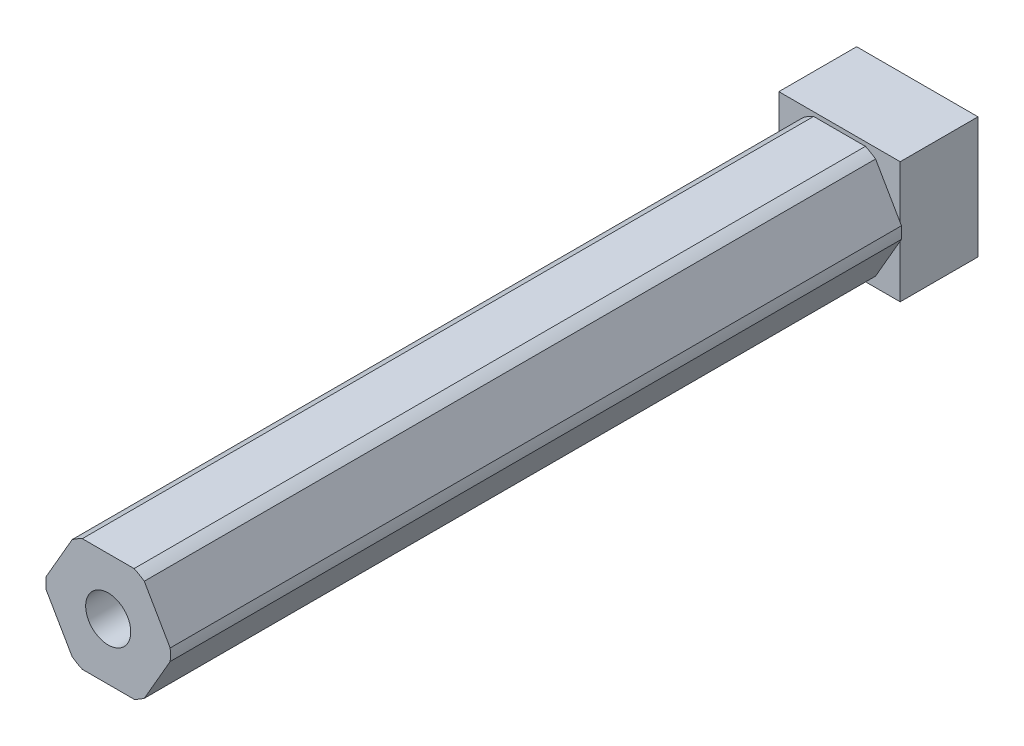
from build123d import *

# Parameters (mm, degrees)
EXTRUDE_1_DEPTH     = 47
SKETCH_2_W          = 7.8
SKETCH_2_H          = 7.8
EXTRUDE_2_DEPTH     = 5
SKETCH_3_R          = 1.45
CUT_EXTRUDE_1_DEPTH = 12.5
SKETCH_4_R          = 3
CUT_EXTRUDE_2_DEPTH = 3
CUT_EXTRUDE_START   = -42.5
SKETCH_3_2_R        = 1.45
CUT_EXTRUDE_3_DEPTH = 9.5


with BuildPart() as part:
    # Эскиз1 → Бобышка-Вытянуть1 (new body)
    with BuildSketch(Plane.XY):
        with BuildLine():
            Line((1.664331698, 3.637306696), (-1.664331698, 3.637306696))
            ThreePointArc((-1.664331698, 3.637306696), (-2, 3.464101615), (-2.317834151, 3.260006878))
            Line((-2.317834151, 3.260006878), (-3.982165849, 0.377299817))
            ThreePointArc((-3.982165849, 0.377299817), (-4, 0), (-3.982165849, -0.377299817))
            Line((-3.982165849, -0.377299817), (-2.317834151, -3.260006878))
            ThreePointArc((-2.317834151, -3.260006878), (-2, -3.464101615), (-1.664331698, -3.637306696))
            Line((-1.664331698, -3.637306696), (1.664331698, -3.637306696))
            ThreePointArc((1.664331698, -3.637306696), (2, -3.464101615), (2.317834151, -3.260006878))
            Line((2.317834151, -3.260006878), (3.982165849, -0.377299817))
            ThreePointArc((3.982165849, -0.377299817), (4, 0), (3.982165849, 0.377299817))
            Line((3.982165849, 0.377299817), (2.317834151, 3.260006878))
            ThreePointArc((2.317834151, 3.260006878), (2, 3.464101615), (1.664331698, 3.637306696))
        make_face()
    extrude(amount=EXTRUDE_1_DEPTH)

    # Эскиз2 → Бобышка-Вытянуть2 (add)
    with BuildSketch(Plane(origin=(0, 0, 0), x_dir=(-1, 0, 0), z_dir=(0, 0, -1))):
        Rectangle(SKETCH_2_W, SKETCH_2_H)
    extrude(amount=EXTRUDE_2_DEPTH)

    # Эскиз3 → Вырез-Вытянуть1 (cut)
    with BuildSketch(Plane(origin=(0, 0, -5), x_dir=(-1, 0, 0), z_dir=(0, 0, -1))):
        Circle(SKETCH_3_R)
    extrude(amount=-CUT_EXTRUDE_1_DEPTH, mode=Mode.SUBTRACT)

    # Эскиз4 → Вырез-Вытянуть2 (cut)
    with BuildSketch(Plane(origin=(0, 0, -5), x_dir=(-1, 0, 0), z_dir=(0, 0, -1))):
        Circle(SKETCH_4_R)
    extrude(amount=-CUT_EXTRUDE_2_DEPTH, mode=Mode.SUBTRACT)

    # Эскиз3<2> → Вырез-Вытянуть3 (cut)
    with BuildSketch(Plane(origin=(0, 0, -5), x_dir=(-1, 0, 0), z_dir=(0, 0, -1)).offset(CUT_EXTRUDE_START)):
        Circle(SKETCH_3_2_R)
    extrude(amount=-CUT_EXTRUDE_3_DEPTH, mode=Mode.SUBTRACT)


solid = part.part
